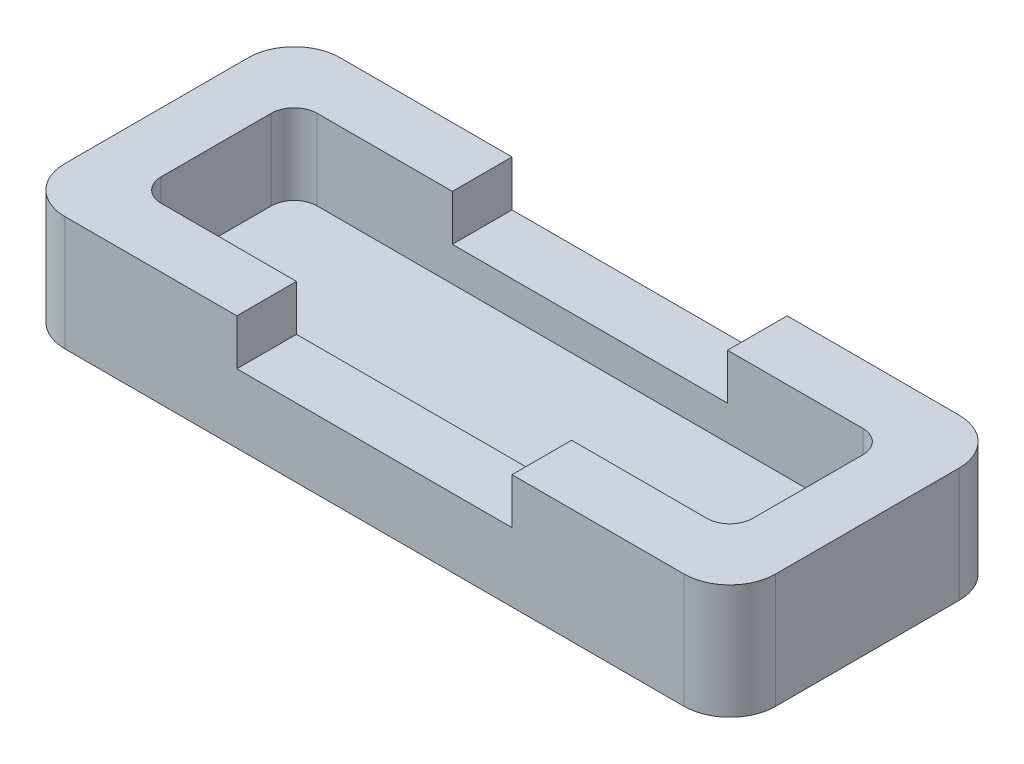
from build123d import *

# Parameters (mm, degrees)
SKETCH1_W                 = 31
SKETCH1_H                 = 12
BOSS_EXTRUDE1_DEPTH       = 5
SHELL1_T                  = -2.6
SHELL1_THICKNESS_2_FACE_W = 6.8
SHELL1_THICKNESS_2_FACE_H = 25.8
SHELL1_THICKNESS_2_DEPTH  = 1.1
SKETCH2_W                 = 12
SKETCH2_H                 = 12
CUT_EXTRUDE1_DEPTH        = 2
FILLET1_R                 = 2
FILLET2_R                 = 1


with BuildPart() as part:
    # Sketch1 → Boss-Extrude1 (new body)
    with BuildSketch(Plane(origin=(0, 0, 0), x_dir=(1, 0, 0), z_dir=(0, 1, 0))):
        Rectangle(SKETCH1_W, SKETCH1_H)
    extrude(amount=BOSS_EXTRUDE1_DEPTH)

    # Shell1
    shell1_openings = [part.faces().sort_by_distance(p)[0] for p in [
        (0, 5, 0),
    ]]
    offset(amount=SHELL1_T, openings=shell1_openings, kind=Kind.INTERSECTION)

    # Shell1 thickness 2 face (on inner face of the shell) → Shell1 thickness 2 (cut)
    with BuildSketch(Plane(origin=(0, 2.6, 0), x_dir=(0, 0, -1), z_dir=(0, -1, 0))):
        Rectangle(SHELL1_THICKNESS_2_FACE_W, SHELL1_THICKNESS_2_FACE_H)
    extrude(amount=SHELL1_THICKNESS_2_DEPTH, mode=Mode.SUBTRACT)

    # Sketch2 → Cut-Extrude1 (cut)
    with BuildSketch(Plane(origin=(0, 5, 0), x_dir=(1, 0, 0), z_dir=(0, 1, 0))):
        Rectangle(SKETCH2_W, SKETCH2_H)
    extrude(amount=-CUT_EXTRUDE1_DEPTH, mode=Mode.SUBTRACT)

    # Fillet1
    fillet1_edges = [part.edges().sort_by_distance(p)[0] for p in [
        (15.5, 2.5, 6),
        (-15.5, 2.5, 6),
        (-15.5, 2.5, -6),
        (15.5, 2.5, -6),
    ]]
    fillet(fillet1_edges, radius=FILLET1_R)

    # Fillet2
    fillet2_edges = [part.edges().sort_by_distance(p)[0] for p in [
        (12.9, 3.25, 3.4),
        (12.9, 3.25, -3.4),
        (-12.9, 3.25, -3.4),
        (-12.9, 3.25, 3.4),
    ]]
    fillet(fillet2_edges, radius=FILLET2_R)


solid = part.part
